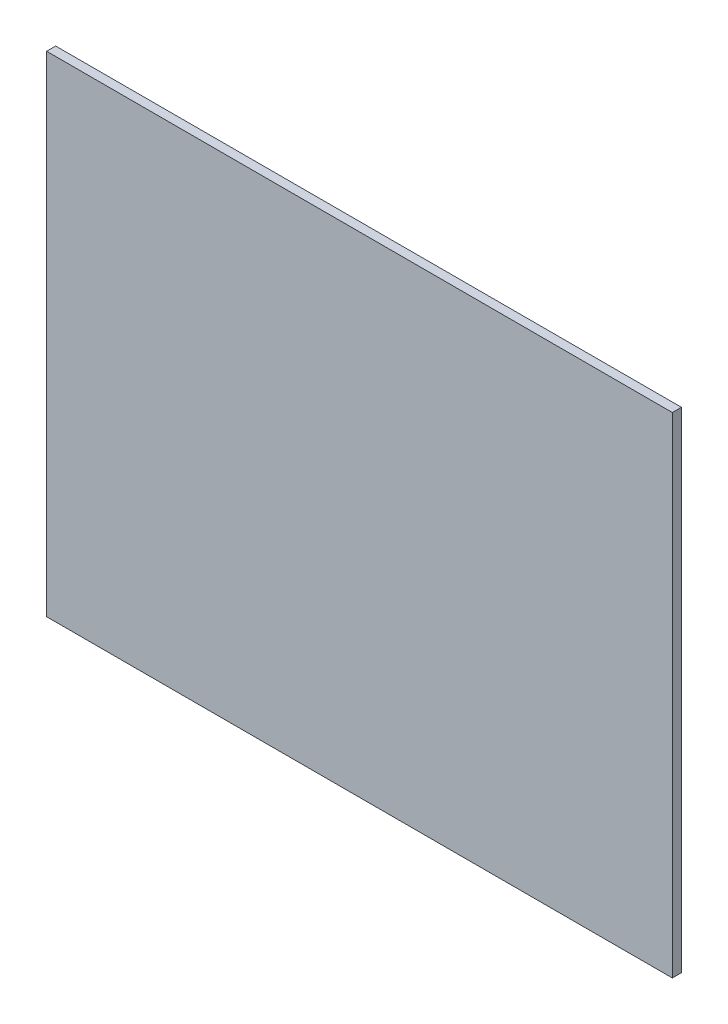
from build123d import *

# Parameters (mm, degrees)
SKETCH1_W           = 270
SKETCH1_H           = 345
BOSS_EXTRUDE1_DEPTH = 5


with BuildPart() as part:
    # Sketch1 → Boss-Extrude1 (new body)
    with BuildSketch(Plane(origin=(0, 0, 0), x_dir=(0, 1, 0), z_dir=(0, 0, 1))):
        with Locations((135, 172.5)):
            Rectangle(SKETCH1_W, SKETCH1_H)
    extrude(amount=BOSS_EXTRUDE1_DEPTH)


solid = part.part
